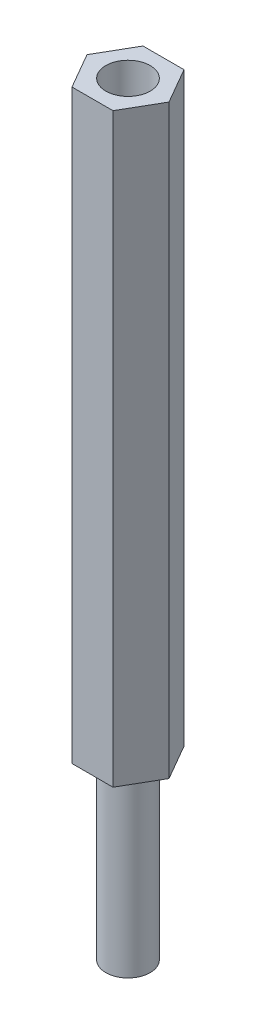
from build123d import *

# Parameters (mm, degrees)
BOSS_EXTRUDE1_DEPTH = 33
SKETCH2_R           = 1.25
BOSS_EXTRUDE2_DEPTH = 10
SKETCH3_R           = 1.25
CUT_EXTRUDE1_DEPTH  = 10


with BuildPart() as part:
    # Sketch1 → Boss-Extrude1 (new body)
    with BuildSketch(Plane(origin=(0, 0, 0), x_dir=(1, 0, 0), z_dir=(0, 1, 0))):
        Polygon((1.154700538, -2), (2.309401077, 0), (1.154700538, 2), (-1.154700538, 2), (-2.309401077, 0), (-1.154700538, -2), align=None)
    extrude(amount=BOSS_EXTRUDE1_DEPTH)

    # Sketch2 → Boss-Extrude2 (add)
    with BuildSketch(Plane(origin=(0, 0, 0), x_dir=(1, 0, 0), z_dir=(0, 1, 0))):
        with Locations(Location((0, 0, 0), (0, 0, 270))):
            Circle(SKETCH2_R)
    extrude(amount=-BOSS_EXTRUDE2_DEPTH)

    # Sketch3 → Cut-Extrude1 (cut)
    with BuildSketch(Plane(origin=(0, 33, 0), x_dir=(1, 0, 0), z_dir=(0, 1, 0))):
        with Locations(Location((0, 0, 0), (0, 0, 270))):
            Circle(SKETCH3_R)
    extrude(amount=-CUT_EXTRUDE1_DEPTH, mode=Mode.SUBTRACT)


solid = part.part
